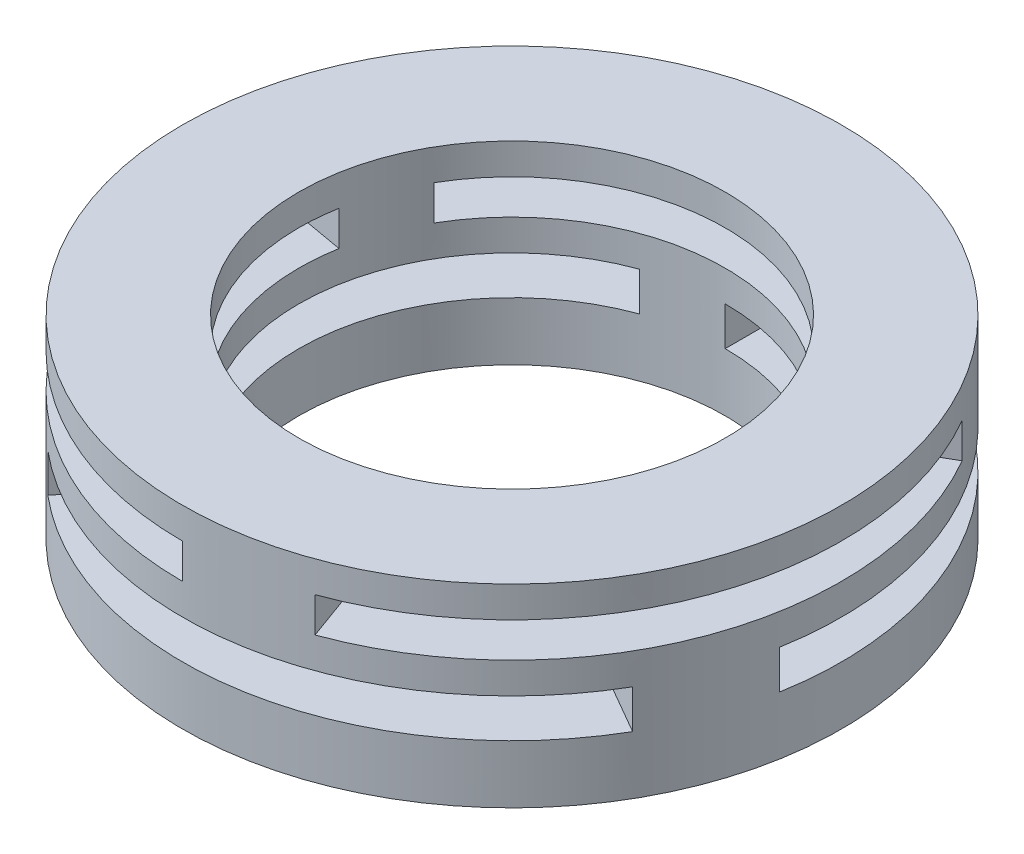
from build123d import *

# Parameters (mm, degrees)
ESBO_O9_W             = 3
ESBO_O9_H             = 5
CORTE_EXTRUS_O1_DEPTH = 1
PADR_OCIRCULAR2_COUNT = 3
CORTE_EXTRUS_O3_START = 0.9
CORTE_EXTRUS_O3_DEPTH = 0.9
PADR_OCIRCULAR4_COUNT = 3


with BuildPart() as part:
    # Esboço9 → Revolução1 (revolve)
    with BuildSketch(Plane.XY, mode=Mode.PRIVATE) as revolu_o1_sk:
        with Locations((7, 2.5)):
            Rectangle(ESBO_O9_W, ESBO_O9_H)
    revolve(revolu_o1_sk.sketch.rotate(Axis((0, -112.760074913, 0), (0, 1, 0)), 180), axis=Axis((0, -112.760074913, 0), (0, 1, 0)))

    # Esboço12 → Corte-extrusão1 (cut)
    with BuildSketch(Plane(origin=(0, 1.5, 0), x_dir=(1, 0, 0), z_dir=(0, 1, 0))):
        with BuildLine():
            Line((0, 8.5), (0, 5.5))
            ThreePointArc((0, 5.5), (4.213244437, 3.535331853), (5.416442642, -0.955064977))
            Line((5.416442642, -0.955064977), (8.370865901, -1.47600951))
            ThreePointArc((8.370865901, -1.47600951), (6.511377767, 5.463694682), (0, 8.5))
        make_face()
    corte_extrus_o1 = extrude(amount=CORTE_EXTRUS_O1_DEPTH, mode=Mode.SUBTRACT)

    # PadrãoCircular2: Corte-extrusão1 ×3 about axis
    padr_ocircular2_axis = Axis((0, 0, 0), (0, 1, 0))
    for i in range(1, PADR_OCIRCULAR2_COUNT):
        add(corte_extrus_o1.rotate(padr_ocircular2_axis, i * 360 / PADR_OCIRCULAR2_COUNT), mode=Mode.SUBTRACT)

    # Esboço13 → Corte-extrusão3 (cut)
    with BuildSketch(Plane(origin=(0, 3.3, 0), x_dir=(1, 0, 0), z_dir=(0, 1, 0)).offset(CORTE_EXTRUS_O3_START)):
        with BuildLine():
            Line((0, 0), (7.361215932, 4.25))
            ThreePointArc((7.361215932, 4.25), (7.987387277, -2.907171218), (2.907171218, -7.987387277))
            Line((2.907171218, -7.987387277), (0, 0))
        make_face()
    corte_extrus_o3 = extrude(amount=-CORTE_EXTRUS_O3_DEPTH, mode=Mode.SUBTRACT)

    # PadrãoCircular4: Corte-extrusão3 ×3 about axis
    padr_ocircular4_axis = Axis((0, 0, 0), (0, 1, 0))
    for i in range(1, PADR_OCIRCULAR4_COUNT):
        add(corte_extrus_o3.rotate(padr_ocircular4_axis, i * 360 / PADR_OCIRCULAR4_COUNT), mode=Mode.SUBTRACT)


solid = part.part
